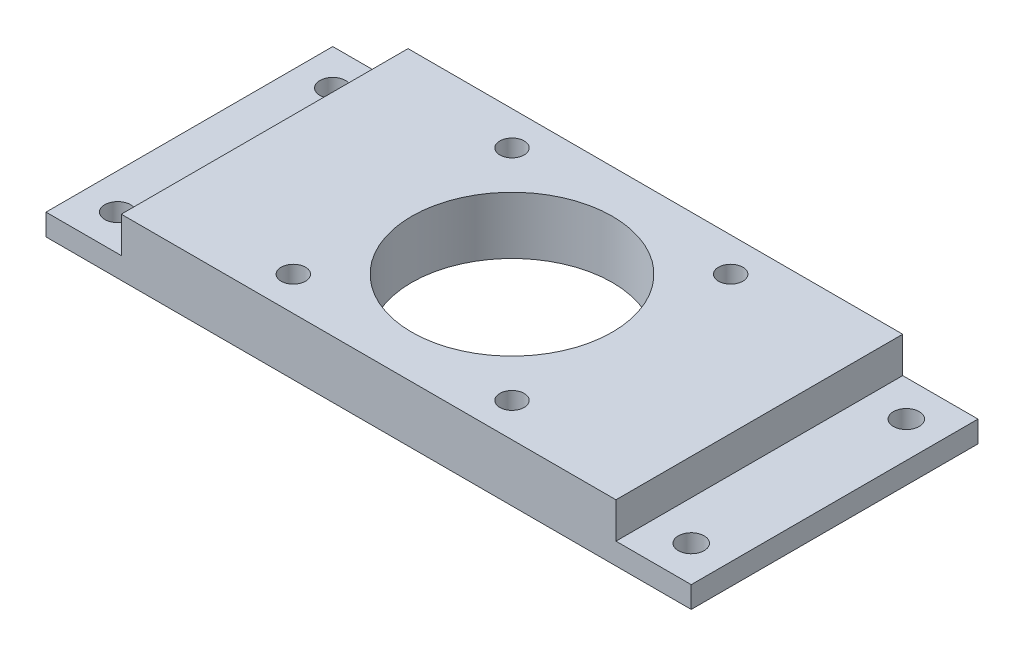
from build123d import *

# Parameters (mm, degrees)
SKETCH1_W            = 70
SKETCH1_H            = 40
BOSS_EXTRUDE1_DEPTH  = 5
SKETCH2_W            = 90
SKETCH2_H            = 40
BOSS_EXTRUDE2_DEPTH  = 3
M3_CLEARANCE_HOLE1_D = 3.6
M3_CLEARANCE_HOLE2_D = 3.4
SKETCH9_R            = 14
CUT_EXTRUDE1_DEPTH   = 50.889878733
SKETCH10_W           = 40
SKETCH10_H           = 5
CUT_EXTRUDE2_DEPTH   = 0.5


with BuildPart() as part:
    # Sketch1 → Boss-Extrude1 (new body)
    with BuildSketch(Plane(origin=(0, 0, 0), x_dir=(1, 0, 0), z_dir=(0, 1, 0))):
        Rectangle(SKETCH1_W, SKETCH1_H)
    extrude(amount=BOSS_EXTRUDE1_DEPTH)

    # Sketch2 → Boss-Extrude2 (add)
    with BuildSketch(Plane.XZ):
        Rectangle(SKETCH2_W, SKETCH2_H)
    extrude(amount=BOSS_EXTRUDE2_DEPTH)

    # M3 Clearance Hole1 (through all)
    with Locations(Plane(origin=(0, 0, 0), x_dir=(1, 0, 0), z_dir=(0, 1, 0))):
        with Locations((-40, 15), (-40, -15), (40, 15), (40, -15)):
            Hole(M3_CLEARANCE_HOLE1_D / 2)

    # M3 Clearance Hole2 (through all)
    with Locations(Plane(origin=(0, 5, 0), x_dir=(1, 0, 0), z_dir=(0, 1, 0))):
        with Locations((0, 0), (15.25, 15.25), (-15.25, -15.25), (-15.25, 15.25), (15.25, -15.25)):
            Hole(M3_CLEARANCE_HOLE2_D / 2)

    # Sketch9 → Cut-Extrude1 (cut, through all)
    with BuildSketch(Plane(origin=(0, 5, 0), x_dir=(1, 0, 0), z_dir=(0, 1, 0))):
        with Locations(Location((0, 0, 0), (0, 0, 270))):
            Circle(SKETCH9_R)
    extrude(amount=-CUT_EXTRUDE1_DEPTH, mode=Mode.SUBTRACT)

    # Sketch10 → Cut-Extrude2 (cut)
    with BuildSketch(Plane.ZY.offset(35)):
        with Locations((0, 2.5)):
            Rectangle(SKETCH10_W, SKETCH10_H)
    cut_extrude2 = extrude(amount=-CUT_EXTRUDE2_DEPTH, mode=Mode.SUBTRACT)

    # Mirror1: Cut-Extrude2 across plane
    add(cut_extrude2.mirror(Plane(origin=(0, 0, 0), x_dir=(0, 0, 1), z_dir=(1, 0, 0))), mode=Mode.SUBTRACT)


solid = part.part
